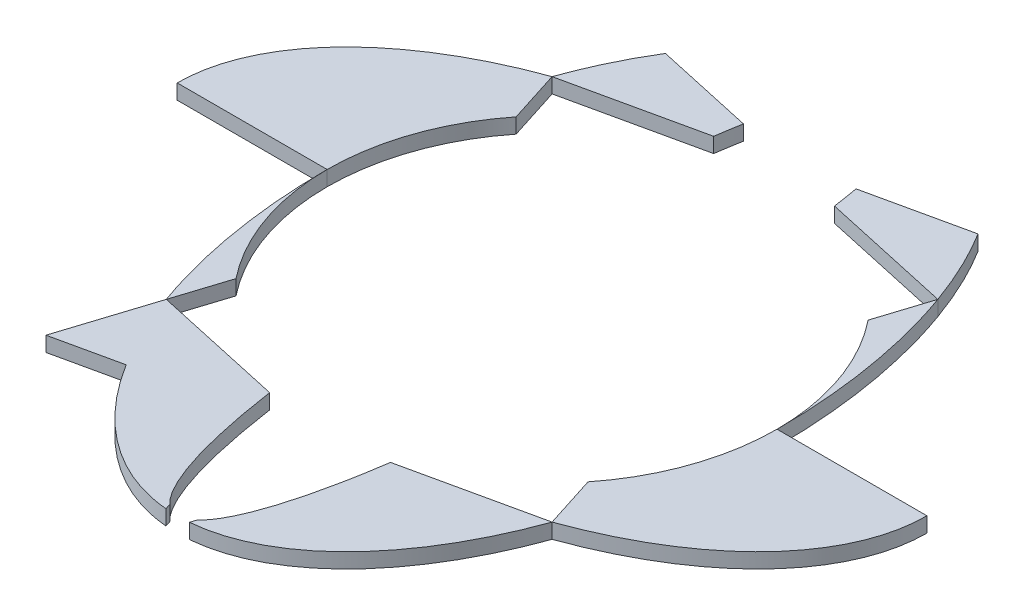
from build123d import *

# Parameters (mm, degrees)
DODANIE_WYCI_GNI_CIE1_DEPTH   = 2
DODANIE_WYCI_GNI_CIE1_2_DEPTH = 2
DODANIE_WYCI_GNI_CIE1_3_DEPTH = 2
DODANIE_WYCI_GNI_CIE1_4_DEPTH = 2
DODANIE_WYCI_GNI_CIE1_5_DEPTH = 2
DODANIE_WYCI_GNI_CIE1_6_DEPTH = 2
DODANIE_WYCI_GNI_CIE1_7_DEPTH = 2
DODANIE_WYCI_GNI_CIE1_8_DEPTH = 2


with BuildPart() as part:
    # Szkic1 → Dodanie-wyciągnięcie1 (new body)
    with BuildSketch(Plane(origin=(0, 0, 0), x_dir=(1, 0, 0), z_dir=(0, 1, 0))):
        with BuildLine():
            Line((-25.724787771, 25.724787771), (-8.05822964, 29.607826273))
            add(Edge.make_bspline(
                [(-7.507535684, 33.029118956), (-7.79792239, 31.378992774), (-8.05822964, 29.607826273)],
                knots=[0.849202104, 0.849202104, 0.849202104, 0.937063931, 0.937063931, 0.937063931], degree=2, weights=[1, 0.999035193, 1]))
            Line((-7.507535684, 33.029118956), (-20.843852414, 35.960387795))
            add(Edge.make_bspline(
                [(-20.843852414, 35.960387795), (-23.68927397, 31.378992774), (-25.724787771, 25.724787771)],
                knots=[3.909727591, 3.909727591, 3.909727591, 4.17196948, 4.17196948, 4.17196948], degree=2, weights=[1, 0.991415958, 1]))
        make_face()
    extrude(amount=DODANIE_WYCI_GNI_CIE1_DEPTH)


with BuildPart() as body_2:
    # Szkic1 → Dodanie-wyci_gni_cie1 2 (new body)
    with BuildSketch(Plane(origin=(0, 0, 0), x_dir=(1, 0, 0), z_dir=(0, 1, 0))):
        with BuildLine():
            Line((-23.475270357, 18.679177757), (-25.724787771, 25.724787771))
            add(Edge.make_bspline(
                [(-25.724787771, 25.724787771), (-50, 16.985711369), (-50, 0)],
                knots=[2.111215827, 2.111215827, 2.111215827, 3.141592654, 3.141592654, 3.141592654], degree=2, weights=[1, 0.870199907, 1]))
            Line((-50, 0), (-30, 0))
            ThreePointArc((-30, 9.5e-08), (-28.321882961, 9.892974554), (-23.475270357, 18.679177757))
        make_face()
    extrude(amount=DODANIE_WYCI_GNI_CIE1_2_DEPTH)


with BuildPart() as body_3:
    # Szkic1 → Dodanie-wyci_gni_cie1 3 (new body)
    with BuildSketch(Plane(origin=(0, 0, 0), x_dir=(1, 0, 0), z_dir=(0, 1, 0))):
        with BuildLine():
            ThreePointArc((-23.475270357, -18.679177757), (-28.321882992, -9.892974465), (-30, 9.5e-08))
            add(Edge.make_bspline(
                [(-30, 9.5e-08), (-30.000000016, -13.849198204), (-25.724787771, -25.724787771)],
                knots=[4.712388978, 4.712388978, 4.712388978, 5.252808481, 5.252808481, 5.252808481], degree=2, weights=[1, 0.963714928, 1]))
            Line((-25.724787771, -25.724787771), (-23.475270357, -18.679177757))
        make_face()
    extrude(amount=DODANIE_WYCI_GNI_CIE1_3_DEPTH)


with BuildPart() as body_4:
    # Szkic1 → Dodanie-wyci_gni_cie1 4 (new body)
    with BuildSketch(Plane(origin=(0, 0, 0), x_dir=(1, 0, 0), z_dir=(0, 1, 0))):
        with BuildLine():
            Line((-29.607826273, -37.88667404), (-20.843852414, -35.960387795))
            add(Edge.make_bspline(
                [(-20.843852414, -35.960387795), (-12.774167321, -48.953336072), (-1.56928672, -49.931545896)],
                knots=[5.51505037, 5.51505037, 5.51505037, 6.230851865, 6.230851865, 6.230851865], degree=2, weights=[1, 0.936634273, 1]))
            Line((-1.56928672, -49.931545896), (-1.811566447, -49.17271271))
            add(Edge.make_bspline(
                [(-7.507535684, -33.029118956), (-5.218865934, -46.034514162), (-1.811566447, -49.17271271)],
                knots=[2.292390549, 2.292390549, 2.292390549, 2.959430225, 2.959430225, 2.959430225], degree=2, weights=[1, 0.944895907, 1]))
            add(Edge.make_bspline(
                [(-8.05822964, -29.607826273), (-7.79792239, -31.378992774), (-7.507535684, -33.029118956)],
                knots=[2.204528722, 2.204528722, 2.204528722, 2.292390549, 2.292390549, 2.292390549], degree=2, weights=[1, 0.999035193, 1]))
            Line((-8.05822964, -29.607826273), (-25.724787771, -25.724787771))
            Line((-25.724787771, -25.724787771), (-29.607826273, -37.88667404))
        make_face()
    extrude(amount=DODANIE_WYCI_GNI_CIE1_4_DEPTH)


with BuildPart() as body_5:
    # Szkic1 → Dodanie-wyci_gni_cie1 5 (new body)
    with BuildSketch(Plane(origin=(0, 0, 0), x_dir=(1, 0, 0), z_dir=(0, 1, 0))):
        with BuildLine():
            Line((8.05822964, 29.607826273), (25.724787771, 25.724787771))
            add(Edge.make_bspline(
                [(25.724787771, 25.724787771), (23.68927397, 31.378992774), (20.843852414, 35.960387795)],
                knots=[2.111215827, 2.111215827, 2.111215827, 2.373457716, 2.373457716, 2.373457716], degree=2, weights=[1, 0.991415958, 1]))
            Line((20.843852414, 35.960387795), (7.507535684, 33.029118956))
            add(Edge.make_bspline(
                [(8.05822964, 29.607826273), (7.79792239, 31.378992774), (7.507535684, 33.029118956)],
                knots=[5.346121376, 5.346121376, 5.346121376, 5.433983203, 5.433983203, 5.433983203], degree=2, weights=[1, 0.999035193, 1]))
        make_face()
    extrude(amount=DODANIE_WYCI_GNI_CIE1_5_DEPTH)


with BuildPart() as body_6:
    # Szkic1 → Dodanie-wyci_gni_cie1 6 (new body)
    with BuildSketch(Plane(origin=(0, 0, 0), x_dir=(1, 0, 0), z_dir=(0, 1, 0))):
        with BuildLine():
            add(Edge.make_bspline(
                [(30, 0), (30, 13.849198247), (25.724787771, 25.724787771)],
                knots=[1.570796327, 1.570796327, 1.570796327, 2.111215827, 2.111215827, 2.111215827], degree=2, weights=[1, 0.963714928, 1]))
            Line((25.724787771, 25.724787771), (23.475270357, 18.679177757))
            ThreePointArc((23.475270357, 18.679177757), (28.321882977, 9.89297451), (30, 0))
        make_face()
    extrude(amount=DODANIE_WYCI_GNI_CIE1_6_DEPTH)


with BuildPart() as body_7:
    # Szkic1 → Dodanie-wyci_gni_cie1 7 (new body)
    with BuildSketch(Plane(origin=(0, 0, 0), x_dir=(1, 0, 0), z_dir=(0, 1, 0))):
        with BuildLine():
            add(Edge.make_bspline(
                [(20.843852414, -35.960387795), (23.68927397, -31.378992774), (25.724787771, -25.724787771)],
                knots=[0.768134938, 0.768134938, 0.768134938, 1.030376827, 1.030376827, 1.030376827], degree=2, weights=[1, 0.991415958, 1]))
            Line((25.724787771, -25.724787771), (8.05822964, -29.607826273))
            add(Edge.make_bspline(
                [(7.507535684, -33.029118956), (7.79792239, -31.378992774), (8.05822964, -29.607826273)],
                knots=[3.990794758, 3.990794758, 3.990794758, 4.078656585, 4.078656585, 4.078656585], degree=2, weights=[1, 0.999035193, 1]))
            add(Edge.make_bspline(
                [(1.811566447, -49.17271271), (5.218865934, -46.034514162), (7.507535684, -33.029118956)],
                knots=[3.323755082, 3.323755082, 3.323755082, 3.990794758, 3.990794758, 3.990794758], degree=2, weights=[1, 0.944895907, 1]))
            Line((1.811566447, -49.17271271), (1.56928672, -49.931545896))
            add(Edge.make_bspline(
                [(1.56928672, -49.931545896), (12.774167321, -48.953336072), (20.843852414, -35.960387795)],
                knots=[0.052333442, 0.052333442, 0.052333442, 0.768134938, 0.768134938, 0.768134938], degree=2, weights=[1, 0.936634273, 1]))
        make_face()
    extrude(amount=DODANIE_WYCI_GNI_CIE1_7_DEPTH)


with BuildPart() as body_8:
    # Szkic1 → Dodanie-wyci_gni_cie1 8 (new body)
    with BuildSketch(Plane(origin=(0, 0, 0), x_dir=(1, 0, 0), z_dir=(0, 1, 0))):
        with BuildLine():
            Line((23.475270357, -18.679177757), (25.724787771, -25.724787771))
            add(Edge.make_bspline(
                [(25.724787771, -25.724787771), (50, -16.985711369), (50, 0)],
                knots=[5.252808481, 5.252808481, 5.252808481, 6.283185307, 6.283185307, 6.283185307], degree=2, weights=[1, 0.870199907, 1]))
            Line((50, 0), (30, 0))
            ThreePointArc((30, 0), (28.321882977, -9.89297451), (23.475270357, -18.679177757))
        make_face()
    extrude(amount=DODANIE_WYCI_GNI_CIE1_8_DEPTH)


solid = Compound([part.part, body_2.part, body_3.part, body_4.part, body_5.part, body_6.part, body_7.part, body_8.part])
